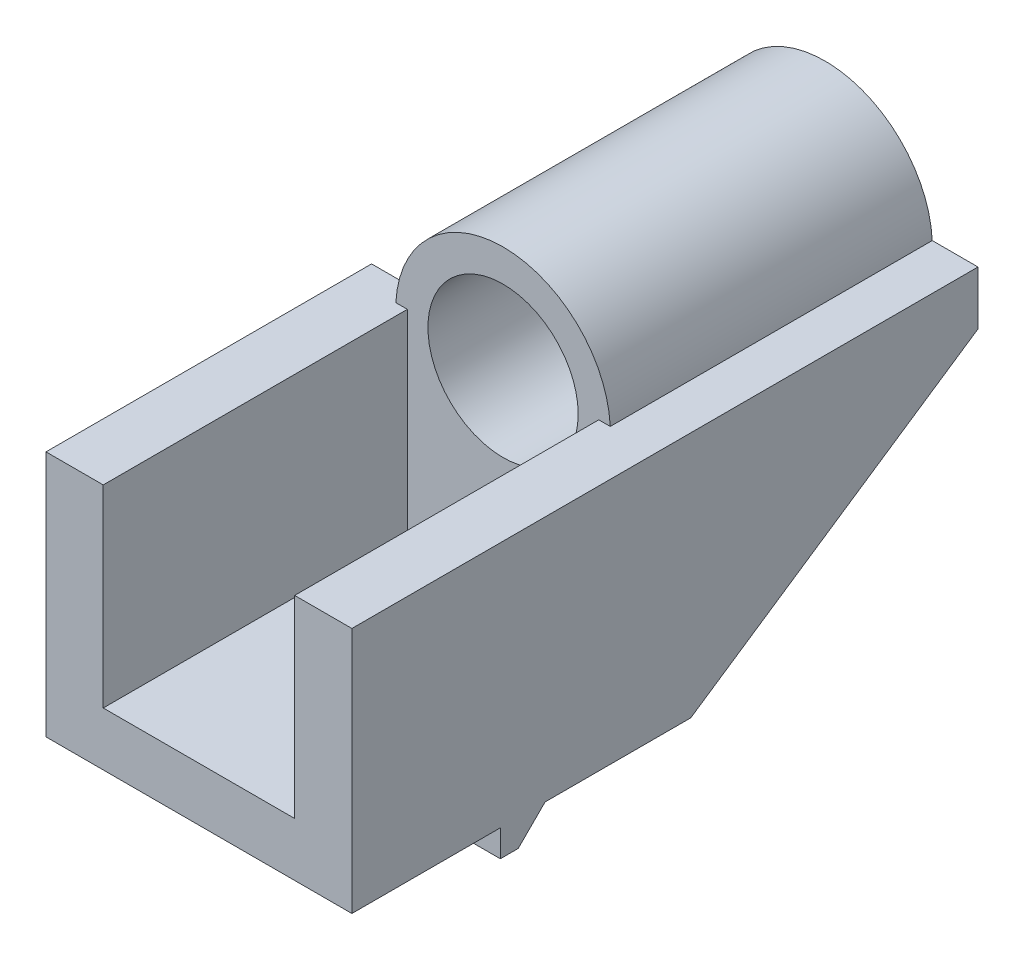
from build123d import *
from build123d.topology import SkipClean

# Parameters (mm, degrees)
BOSS_EXTRUDE1_DEPTH     = 8.55
SKETCH2_W               = 10.7
SKETCH2_H               = 10.8
CUT_EXTRUDE1_DEPTH      = 17
SKETCH3_R               = 6
BOSS_EXTRUDE2_DEPTH     = 18
SKETCH4_R               = 4.2
CUT_EXTRUDE2_DEPTH      = 25.239275979
BOSS_EXTRUDE5_DEPTH     = 17.1
SKETCH7_R               = 2.2
CUT_EXTRUDE3_DEPTH      = 40.626944786
CUT_EXTRUDE4_REACH      = 33.94
SKETCH10_W              = 8.106
SKETCH10_H              = 1.5
SKETCH11_W              = 6.997
SKETCH11_H              = 1
CUT_EXTRUDE5_DEPTH      = 27.591587091
CUT_EXTRUDE6_REACH      = 42.967
CUT_EXTRUDE6_END_RADIUS = 6
CUT_EXTRUDE7_START      = -16.8
CUT_EXTRUDE7_DEPTH      = 16.8
BOSS_EXTRUDE6_DEPTH     = 1.553
BOSS_EXTRUDE7_REACH     = 36.128
CUT_EXTRUDE8_START      = -16.8
CUT_EXTRUDE8_DEPTH      = 16.8
CUT_EXTRUDE9_REACH      = 43.851


with BuildPart() as part:
    # Sketch1 → Boss-Extrude1 (new, symmetric)
    with BuildSketch(Plane(origin=(0, 0, 0), x_dir=(0, 0, -1), z_dir=(1, 0, 0))):
        Polygon((0, 0), (0, -3), (-16.0587, -13.8), (-35, -13.8), (-35, 0), align=None)
    extrude(amount=BOSS_EXTRUDE1_DEPTH, both=True)

    # Sketch2 → Cut-Extrude1 (cut)
    with BuildSketch(Plane.XY.offset(35)):
        with Locations((0, -5.4)):
            Rectangle(SKETCH2_W, SKETCH2_H)
    extrude(amount=-CUT_EXTRUDE1_DEPTH, mode=Mode.SUBTRACT)

    # Sketch3 → Boss-Extrude2 (add, through all)
    with BuildSketch(Plane.XY.offset(18)):
        with Locations((0, -0.30175)):
            Circle(SKETCH3_R)
    extrude(amount=-BOSS_EXTRUDE2_DEPTH)

    # Sketch4 → Cut-Extrude2 (cut, through all)
    with BuildSketch(Plane.XY.offset(18)):
        with Locations((0, -0.30175)):
            Circle(SKETCH4_R)
    extrude(amount=-CUT_EXTRUDE2_DEPTH, mode=Mode.SUBTRACT)

    # Sketch8 → Boss-Extrude5 (add, through all)
    with BuildSketch(Plane(origin=(8.55, 0, 0), x_dir=(0, 0, -1), z_dir=(1, 0, 0))):
        Polygon((-26.702, -13.8), (-26.702, -15.3), (-25.702, -15.3), (-24.202, -13.8), align=None)
        Polygon((-16.0587, -13.8), (-15.002, -13.8), (-15.002, -14.8), (-14.002, -14.8), (-13, -13.8), (-11.045997115, -10.428793666), align=None)
    extrude(amount=-BOSS_EXTRUDE5_DEPTH)

    # Sketch7 → Cut-Extrude3 (cut, through all)
    with BuildSketch(Plane(origin=(0, -10.8, 0), x_dir=(1, 0, 0), z_dir=(0, 1, 0))):
        with Locations(Location((0, -25, 0), (0, 0, 180))):
            Circle(SKETCH7_R)
    extrude(amount=-CUT_EXTRUDE3_DEPTH, mode=Mode.SUBTRACT)

    # Cut-Extrude4: up to this plane
    cut_extrude4_end = Plane(origin=(-8.55, -15.3, 25.702), z_dir=(0, -0.7071067811865471, -0.707106781186548))
    # Sketch10 → Cut-Extrude4 (cut, up to the surface)
    with BuildSketch(Plane.XY.offset(26.702), mode=Mode.PRIVATE) as cut_extrude4_sk1:
        with Locations((0, -14.55)):
            Rectangle(SKETCH10_W, SKETCH10_H)
    cut_extrude4_tool1 = split(extrude(cut_extrude4_sk1.sketch, amount=-CUT_EXTRUDE4_REACH, mode=Mode.PRIVATE), bisect_by=cut_extrude4_end, keep=Keep.BOTH, mode=Mode.PRIVATE)
    add(cut_extrude4_tool1.solids().sort_by_distance((0, -14.55, 26.702))[0], mode=Mode.SUBTRACT)

    # Sketch11 → Cut-Extrude5 (cut, through all)
    with BuildSketch(Plane.XY.offset(15.002)):
        with Locations((-5.0515, -14.3)):
            Rectangle(SKETCH11_W, SKETCH11_H)
        with Locations((5.0515, -14.3)):
            Rectangle(SKETCH11_W, SKETCH11_H)
    extrude(amount=-CUT_EXTRUDE5_DEPTH, mode=Mode.SUBTRACT)

    # Cut-Extrude6: up to this cylinder (the profile starts outside it)
    cut_extrude6_end = Plane(origin=(0, -0.30175, 7.230062), z_dir=(0, 0, 1)) * Cylinder(CUT_EXTRUDE6_END_RADIUS, 98.934, mode=Mode.PRIVATE)
    # Sketch12 → Cut-Extrude6 (cut, up to the surface)
    with BuildSketch(Plane.XZ.offset(13.8), mode=Mode.PRIVATE) as cut_extrude6_sk1:
        Polygon((-1.553, 13), (-5.353, 16.8), (-5.353, 0), (5.353, 0), (5.353, 16.8), (1.553, 13), align=None)
    cut_extrude6_tool1 = extrude(cut_extrude6_sk1.sketch, amount=-CUT_EXTRUDE6_REACH, mode=Mode.PRIVATE) - cut_extrude6_end
    add(cut_extrude6_tool1.solids().sort_by_distance((0, -13.8, 7.230062))[0], mode=Mode.SUBTRACT)

    # Sketch13 → Cut-Extrude7 (cut)
    with SkipClean():  # the faces are left unmerged after this step: merging them gives an invalid solid
        with BuildSketch(Plane(origin=(0, 0, 0), x_dir=(-1, 0, 0), z_dir=(0, 0, -1)).offset(CUT_EXTRUDE7_START)):
            with BuildLine():
                Line((-5.359052802, -3), (-5.353, -10.428793666))
                Line((-5.353, -10.428793666), (5.353, -10.428793666))
                Line((5.353, -10.428793666), (5.359052802, -3))
                ThreePointArc((5.359052802, -3), (0, -6.30175), (-5.359052802, -3))
            make_face()
        extrude(amount=CUT_EXTRUDE7_DEPTH, mode=Mode.SUBTRACT)

    # Sketch14 → Boss-Extrude6 (add, symmetric)
    with SkipClean():  # the faces are left unmerged after this step: merging them gives an invalid solid
        with BuildSketch(Plane(origin=(0, 0, 0), x_dir=(0, 0, -1), z_dir=(1, 0, 0))):
            Polygon((-13, -13.8), (-8.073269662, -5.3), (-16.8, -5.3), (-16.8, -13.8), align=None)
        extrude(amount=BOSS_EXTRUDE6_DEPTH, both=True)

    # Sketch15 → Boss-Extrude7 (add, up to next)
    with BuildSketch(Plane(origin=(-7.436377386, -6.523873454, 7.436377386), x_dir=(-0.7993387140757535, 0.3962687040508023, -0.4516953999872244), z_dir=(0.6008807037838052, 0.5271477588310114, -0.6008807037838052)), mode=Mode.PRIVATE) as boss_extrude7_sk1:
        Polygon((-11.246017774, 0.733681451), (-11.246017774, 6.495798547), (-15.999947407, 3.239704803), align=None)
    boss_extrude7_tool1 = extrude(boss_extrude7_sk1.sketch, amount=-BOSS_EXTRUDE7_REACH, mode=Mode.PRIVATE) - part.part
    boss_extrude7 = boss_extrude7_tool1.solids().sort_by_distance((2.819667, -8.984956, 15.533333))[0]
    add(boss_extrude7)

    # Mirror1: Boss-Extrude7 across plane
    with SkipClean():  # the faces are left unmerged after this step: merging them gives an invalid solid
        add(boss_extrude7.mirror(Plane(origin=(0, 0, 0), x_dir=(0, 0, 1), z_dir=(1, 0, 0))))

    # Sketch16 → Cut-Extrude8 (cut)
    with SkipClean():  # the faces are left unmerged after this step: merging them gives an invalid solid
        with BuildSketch(Plane(origin=(0, 0, 0), x_dir=(-1, 0, 0), z_dir=(0, 0, -1)).offset(CUT_EXTRUDE8_START)):
            with BuildLine():
                Line((5.992407441, 0), (8.55, 0))
                Line((8.55, 0), (8.55, -13.8))
                Line((8.55, -13.8), (5.353, -13.8))
                Line((5.353, -13.8), (5.353, -3.011988181))
                ThreePointArc((5.353, -3.011988181), (5.869206565, -1.547709188), (5.992407441, 0))
            make_face()
        extrude(amount=CUT_EXTRUDE8_DEPTH, mode=Mode.SUBTRACT)

    # Sketch17 → Cut-Extrude9 (cut, up to next)
    with BuildSketch(Plane(origin=(8.55, 0, 0), x_dir=(0, 0, -1), z_dir=(1, 0, 0)), mode=Mode.PRIVATE) as cut_extrude9_sk1:
        Polygon((-11.045997115, -10.428793666), (-13, -13.8), (-16.0587, -13.8), align=None)
    cut_extrude9_tool1 = extrude(cut_extrude9_sk1.sketch, amount=-CUT_EXTRUDE9_REACH, mode=Mode.PRIVATE) & part.part
    add(cut_extrude9_tool1.solids().sort_by_distance((8.55, -12.676265, 13.368232))[0], mode=Mode.SUBTRACT)


solid = part.part
